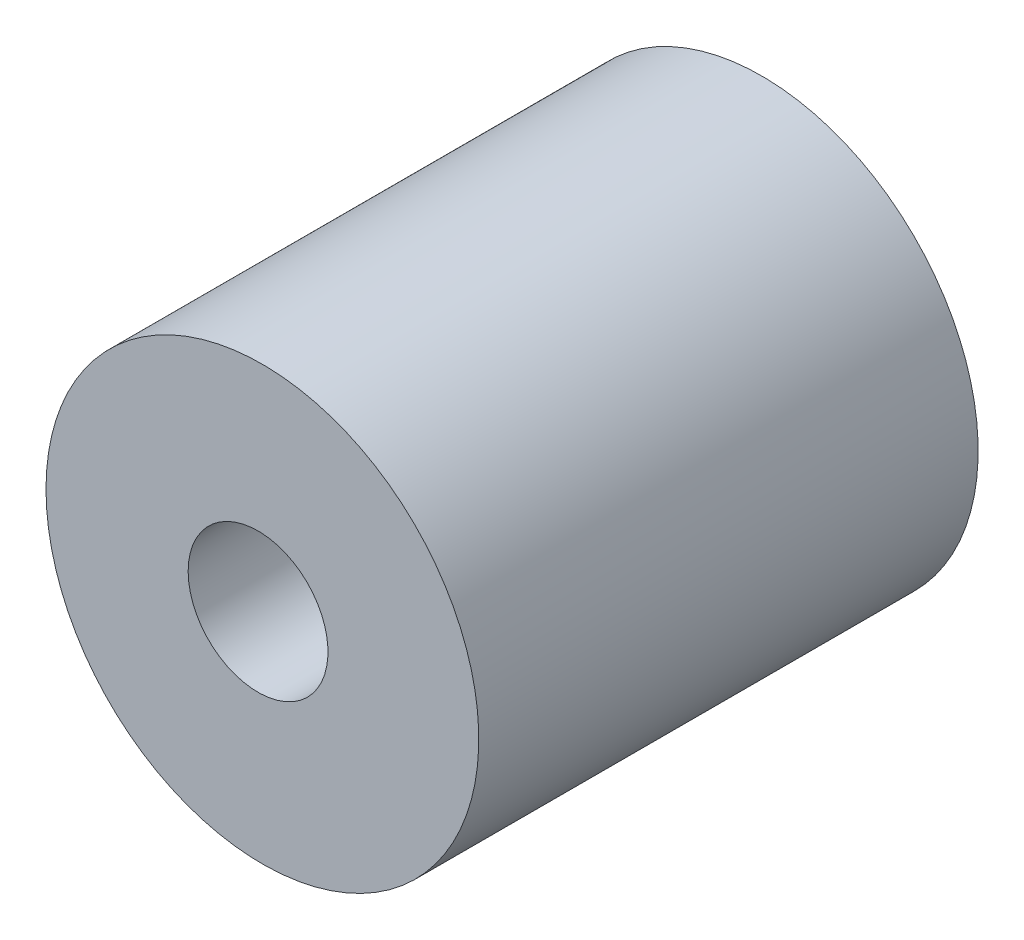
from build123d import *

# Parameters (mm, degrees)
SKETCH1_R           = 8.255
SKETCH1_R_2         = 2.667
BOSS_EXTRUDE1_DEPTH = 19.05


with BuildPart() as part:
    # Sketch1 → Boss-Extrude1 (new body)
    with BuildSketch(Plane.XY):
        with Locations(Location((0.165429311, 0, 0), (0, 0, 180))):
            Circle(SKETCH1_R)
        with Locations(Location((0, 0, 0), (0, 0, 180))):
            Circle(SKETCH1_R_2, mode=Mode.SUBTRACT)
    extrude(amount=BOSS_EXTRUDE1_DEPTH)


solid = part.part
